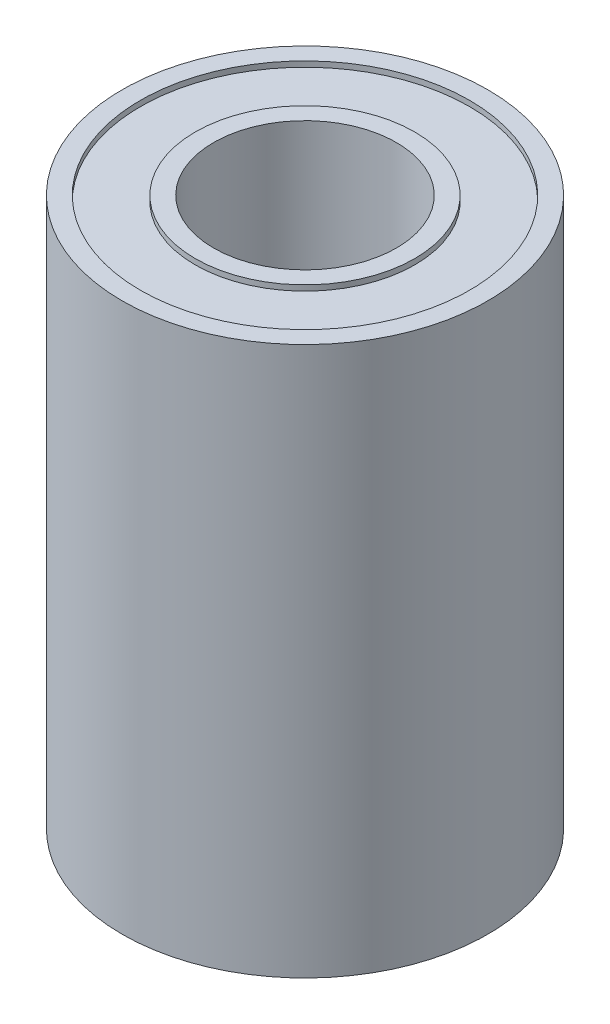
from build123d import *

# Parameters (mm, degrees)
SKETCH_1_R          = 5
SKETCH_1_R_2        = 2.5
EXTRUDE_1_DEPTH     = 7.5
SKETCH_2_R          = 4.5
SKETCH_2_R_2        = 3
CUT_EXTRUDE_1_DEPTH = 0.15


with BuildPart() as part:
    # Эскиз1 → Бобышка-Вытянуть1 (new body)
    with BuildSketch(Plane(origin=(0, 0, 0), x_dir=(1, 0, 0), z_dir=(0, 1, 0))):
        with Locations(Location((0, 0, 0), (0, 0, 270))):
            Circle(SKETCH_1_R)
        with Locations(Location((0, 0, 0), (0, 0, 270))):
            Circle(SKETCH_1_R_2, mode=Mode.SUBTRACT)
    extrude(amount=EXTRUDE_1_DEPTH)

    # Эскиз2 → Вырез-Вытянуть1 (cut)
    with BuildSketch(Plane(origin=(0, 7.5, 0), x_dir=(1, 0, 0), z_dir=(0, 1, 0))):
        with Locations(Location((0, 0, 0), (0, 0, 270))):
            Circle(SKETCH_2_R)
        with Locations(Location((0, 0, 0), (0, 0, 270))):
            Circle(SKETCH_2_R_2, mode=Mode.SUBTRACT)
    extrude(amount=-CUT_EXTRUDE_1_DEPTH, mode=Mode.SUBTRACT)

    # Зеркальное отражение1: part across plane


with BuildPart() as part_1:
    add(part.part)
    add(part.part.mirror(Plane.ZX))


solid = part_1.part
